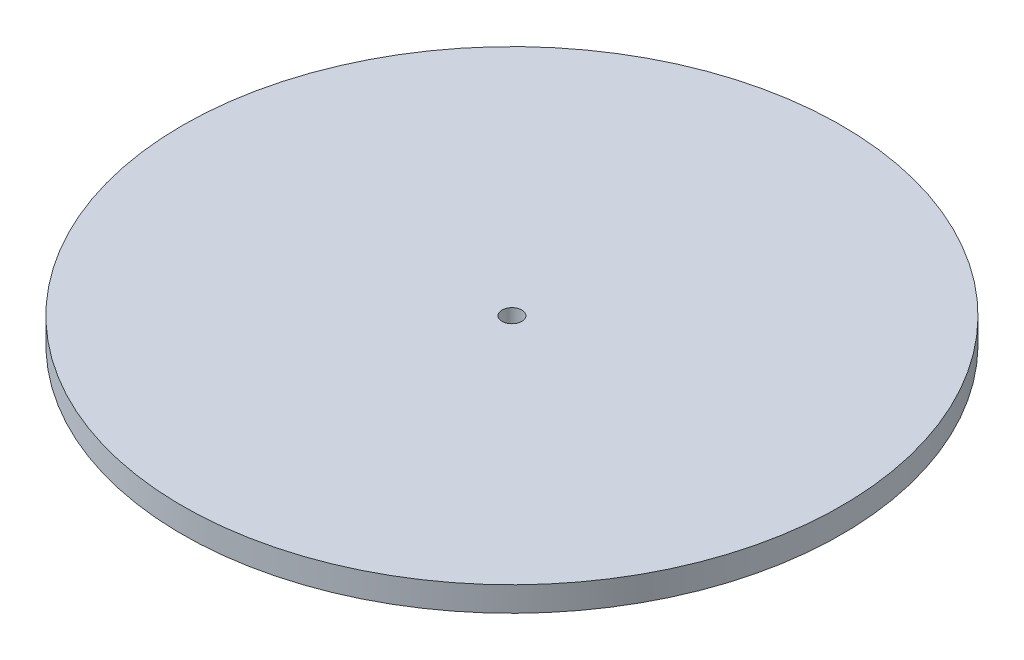
from build123d import *

# Parameters (mm, degrees)
SKETCH5_R          = 1.2
CUT_EXTRUDE1_DEPTH = 59.877274304


with BuildPart() as part:
    # Sketch3 → Revolve4 (revolve)
    with BuildSketch(Plane.XY, mode=Mode.PRIVATE) as revolve4_sk:
        with BuildLine():
            Line((1.2, 16.325750899), (1.2, 11.325750899))
            Line((1.2, 11.325750899), (0, 11.325750899))
            Line((0, 11.325750899), (0, 0))
            add(Edge.make_bspline(
                [(0, 0), (4.624999983, -0.014967436), (9.249999981, 1.24401094), (13.874999988, 3.457379816), (18.499999987, 4.949562998), (23.124999994, 7.086165744), (27.749999995, 8.78082699), (32.374999998, 10.606839572), (37, 12.325750899)],
                knots=[0.083359662, 0.083359662, 0.083359662, 0.083359662, 0.083359662, 0.083359662, 0.083359662, 0.083359662, 0.083359662, 0.916956275, 0.916956275, 0.916956275, 0.916956275, 0.916956275, 0.916956275, 0.916956275, 0.916956275, 0.916956275], degree=8))
            Line((37, 12.325750899), (37, 13.325750899))
            Line((37, 13.325750899), (40, 13.325750899))
            Line((40, 13.325750899), (40, 16.325750899))
            Line((40, 16.325750899), (1.2, 16.325750899))
        make_face()
    revolve(revolve4_sk.sketch.rotate(Axis((0, 16.325750899, 0), (0, -1, 0)), 180), axis=Axis((0, 16.325750899, 0), (0, -1, 0)))

    # Sketch5 → Cut-Extrude1 (cut, through all)
    with BuildSketch(Plane(origin=(0, 16.325750899, 0), x_dir=(1, 0, 0), z_dir=(0, 1, 0))):
        with Locations(Location((0, 0, 0), (0, 0, 180))):
            Circle(SKETCH5_R)
    extrude(amount=-CUT_EXTRUDE1_DEPTH, mode=Mode.SUBTRACT)


solid = part.part
